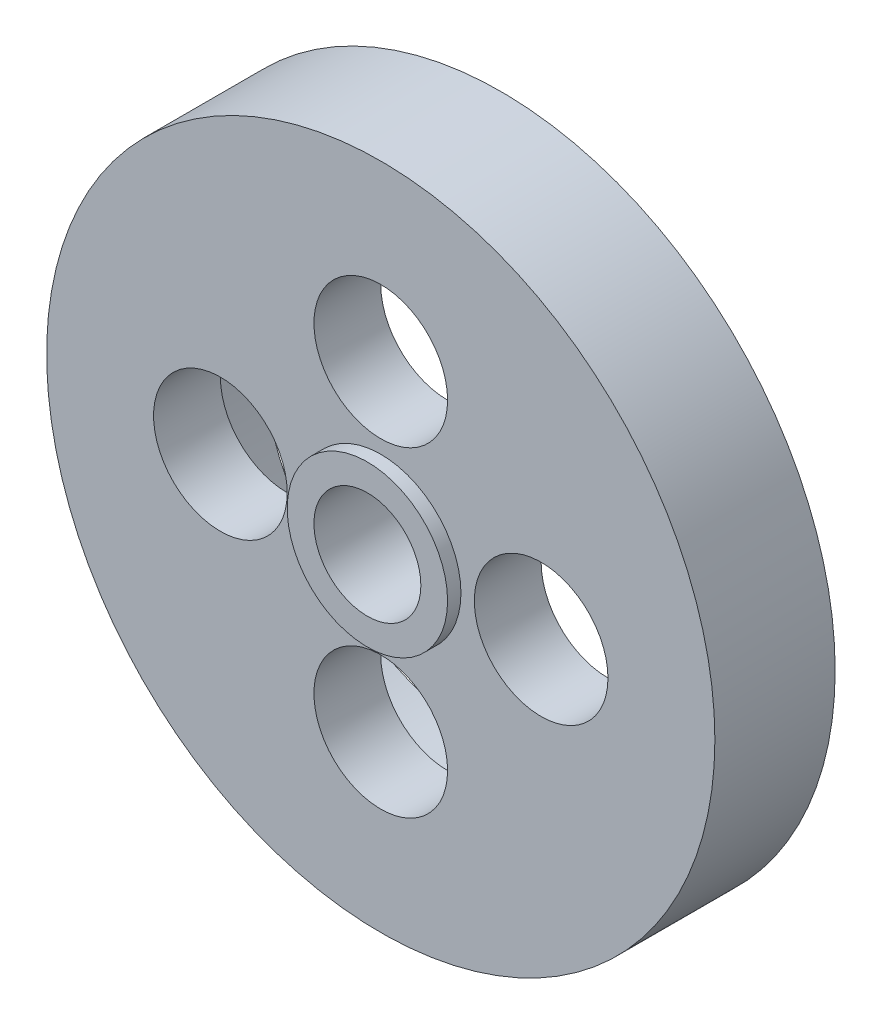
from build123d import *

# Parameters (mm, degrees)
SKETCH1_R           = 25
BOSS_EXTRUDE1_DEPTH = 9
SKETCH2_R           = 18
CUT_EXTRUDE1_DEPTH  = 4
SKETCH3_R           = 5
CUT_EXTRUDE2_DEPTH  = 37.482872694
SKETCH4_R           = 6
BOSS_EXTRUDE2_DEPTH = 1
SKETCH5_R           = 4
CUT_EXTRUDE3_DEPTH  = 37.742346142


with BuildPart() as part:
    # Sketch1 → Boss-Extrude1 (new body)
    with BuildSketch(Plane.XY):
        Circle(SKETCH1_R)
    extrude(amount=BOSS_EXTRUDE1_DEPTH)

    # Sketch2 → Cut-Extrude1 (cut)
    with BuildSketch(Plane(origin=(0, 0, 0), x_dir=(-1, 0, 0), z_dir=(0, 0, -1))):
        Circle(SKETCH2_R)
    extrude(amount=-CUT_EXTRUDE1_DEPTH, mode=Mode.SUBTRACT)

    # Sketch3 → Cut-Extrude2 (cut, through all)
    with BuildSketch(Plane.XY.offset(9)):
        with Locations((0, 12)):
            Circle(SKETCH3_R)
        with Locations((12, 0)):
            Circle(SKETCH3_R)
        with Locations((0, -12)):
            Circle(SKETCH3_R)
        with Locations((-12, 0)):
            Circle(SKETCH3_R)
    extrude(amount=-CUT_EXTRUDE2_DEPTH, mode=Mode.SUBTRACT)

    # Sketch4 → Boss-Extrude2 (add)
    with BuildSketch(Plane.XY.offset(9)):
        Circle(SKETCH4_R)
    extrude(amount=BOSS_EXTRUDE2_DEPTH)

    # Sketch5 → Cut-Extrude3 (cut, through all)
    with BuildSketch(Plane.XY.offset(10)):
        Circle(SKETCH5_R)
    extrude(amount=-CUT_EXTRUDE3_DEPTH, mode=Mode.SUBTRACT)


solid = part.part
